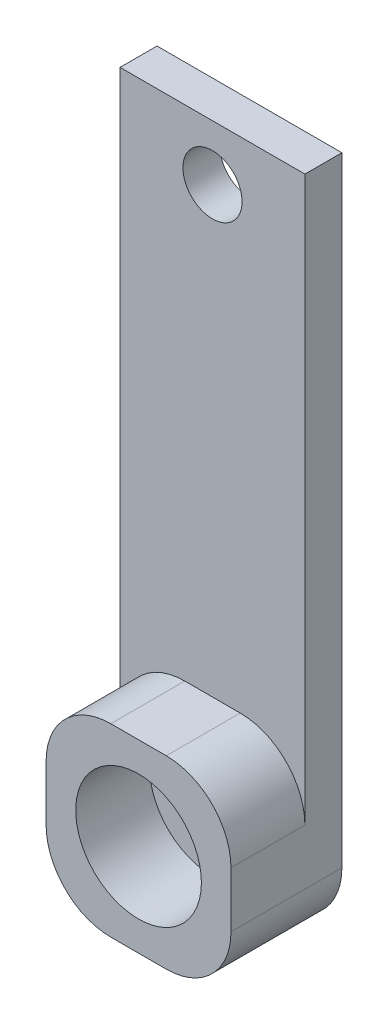
from build123d import *

# Parameters (mm, degrees)
SKETCH1_W           = 10
SKETCH1_H           = 37
BOSS_EXTRUDE1_DEPTH = 2
SKETCH2_W           = 10
SKETCH2_H           = 10
SKETCH2_R           = 3.4
BOSS_EXTRUDE2_DEPTH = 4
SKETCH3_R           = 1.6
CUT_EXTRUDE1_DEPTH  = 2
FILLET1_R           = 3.5
SKETCH4_R           = 1.5
CUT_EXTRUDE2_DEPTH  = 2


with BuildPart() as part:
    # Sketch1 → Boss-Extrude1 (new body)
    with BuildSketch(Plane.XY):
        with Locations((-12.863567867, 10.18847884)):
            Rectangle(SKETCH1_W, SKETCH1_H)
    extrude(amount=BOSS_EXTRUDE1_DEPTH)

    # Sketch2 → Boss-Extrude2 (add)
    with BuildSketch(Plane.XY.offset(2)):
        with Locations((-12.863567867, -3.31152116)):
            Rectangle(SKETCH2_W, SKETCH2_H)
        with Locations((-12.863567867, -3.31152116)):
            Circle(SKETCH2_R, mode=Mode.SUBTRACT)
    extrude(amount=BOSS_EXTRUDE2_DEPTH)

    # Sketch3 → Cut-Extrude1 (cut)
    with BuildSketch(Plane.XY.offset(2)):
        with Locations((-12.863567867, 25.68847884)):
            Circle(SKETCH3_R)
    extrude(amount=-CUT_EXTRUDE1_DEPTH, mode=Mode.SUBTRACT)

    # Fillet1
    fillet1_edges = [part.edges().sort_by_distance(p)[0] for p in [
        (-7.863567867, -8.31152116, 3),
        (-17.863567867, -8.31152116, 3),
        (-17.863567867, 1.68847884, 4),
        (-7.863567867, 1.68847884, 4),
    ]]
    fillet(fillet1_edges, radius=FILLET1_R)

    # Sketch4 → Cut-Extrude2 (cut)
    with BuildSketch(Plane.XY.offset(2)):
        with Locations((-12.863567867, -3.31152116)):
            Circle(SKETCH4_R)
    extrude(amount=-CUT_EXTRUDE2_DEPTH, mode=Mode.SUBTRACT)


solid = part.part
